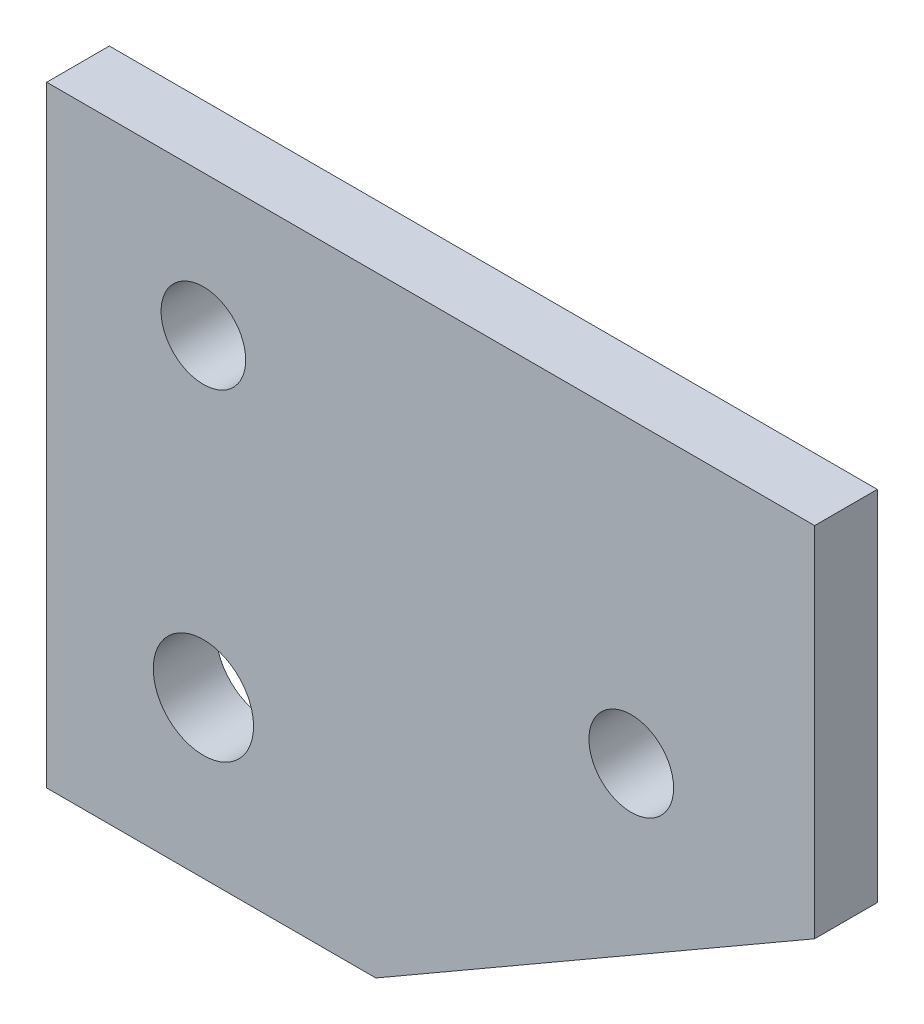
from build123d import *

# Parameters (mm, degrees)
SKETCH_1_W          = 49
SKETCH_1_H          = 39
EXTRUDE_1_DEPTH     = 4
CUT_EXTRUDE_1_DEPTH = 13
SKETCH_4_R          = 2.7
CUT_EXTRUDE_2_DEPTH = 17
SKETCH_5_R          = 2.7
SKETCH_5_R_2        = 3.2
CUT_EXTRUDE_3_DEPTH = 17


with BuildPart() as part:
    # 草图1 → 凸台-拉伸1 (new body)
    with BuildSketch(Plane.XY):
        with Locations((-31.928797257, 1.614086391)):
            Rectangle(SKETCH_1_W, SKETCH_1_H)
    extrude(amount=EXTRUDE_1_DEPTH)

    # 草图2 → 切除-拉伸1 (cut)
    with BuildSketch(Plane.XY):
        Polygon((-7.428797257, -17.885913609), (-35.428797257, -17.885913609), (5.926023005, 5.990303001), align=None)
    extrude(amount=CUT_EXTRUDE_1_DEPTH, mode=Mode.SUBTRACT)

    # 草图4 → 切除-拉伸2 (cut)
    with BuildSketch(Plane.XY):
        with Locations((-19.128797257, 2.114086391)):
            Circle(SKETCH_4_R)
    extrude(amount=CUT_EXTRUDE_2_DEPTH, mode=Mode.SUBTRACT)

    # 草图5 → 切除-拉伸3 (cut)
    with BuildSketch(Plane.XY):
        with Locations((-46.428797257, 12.114086391)):
            Circle(SKETCH_5_R)
        with Locations((-46.428797257, -7.885913609)):
            Circle(SKETCH_5_R_2)
    extrude(amount=CUT_EXTRUDE_3_DEPTH, mode=Mode.SUBTRACT)


solid = part.part
